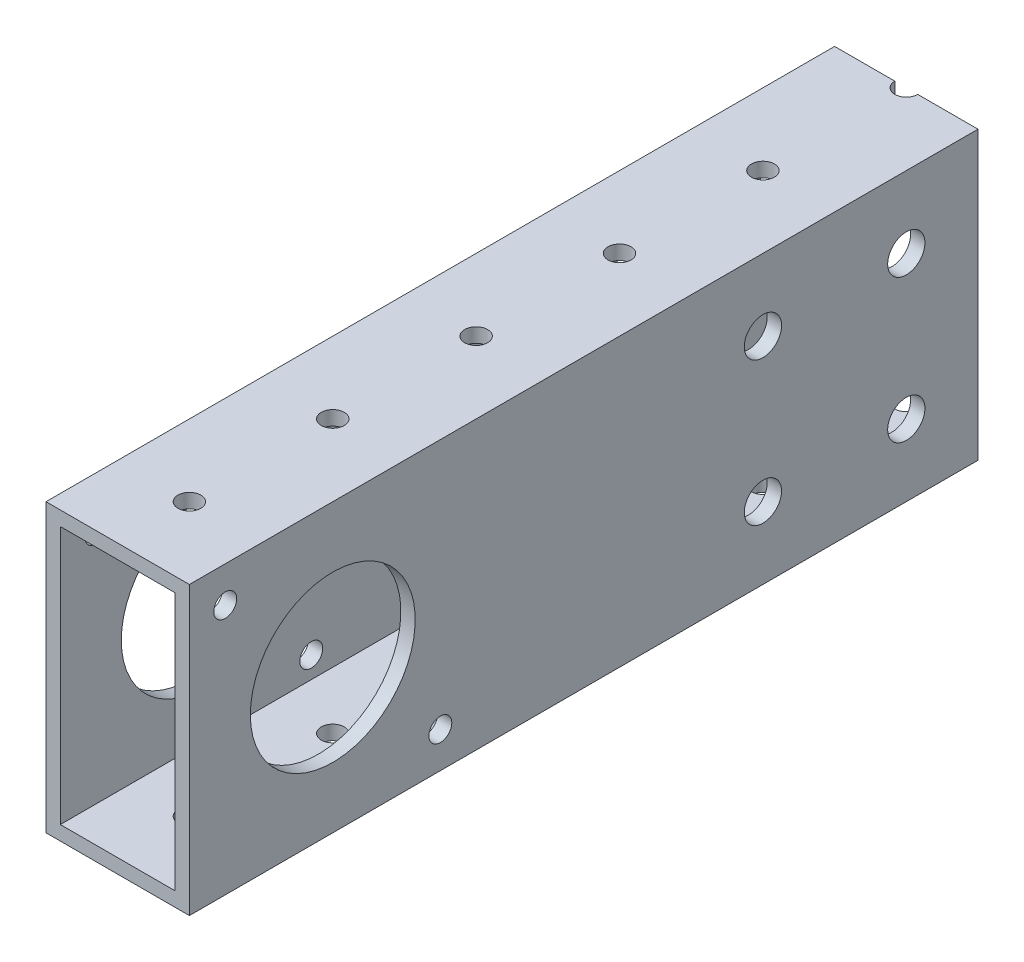
from build123d import *

# Parameters (mm, degrees)
SKETCH1_W           = 25.4
SKETCH1_H           = 50.8
SKETCH1_W_2         = 20.32
SKETCH1_H_2         = 45.72
BOSS_EXTRUDE1_DEPTH = 139.7
SKETCH2_R           = 2.032
CUT_EXTRUDE1_DEPTH  = 150.191219581
SKETCH3_R           = 2.032
SKETCH3_R_2         = 14.605
SKETCH3_R_3         = 3.302
CUT_EXTRUDE2_DEPTH  = 145.244271983


with BuildPart() as part:
    # Sketch1 → Boss-Extrude1 (new body)
    with BuildSketch(Plane.XY):
        Rectangle(SKETCH1_W, SKETCH1_H)
        Rectangle(SKETCH1_W_2, SKETCH1_H_2, mode=Mode.SUBTRACT)
    extrude(amount=BOSS_EXTRUDE1_DEPTH)

    # Sketch2 → Cut-Extrude1 (cut, through all)
    with BuildSketch(Plane(origin=(0, 25.4, 0), x_dir=(1, 0, 0), z_dir=(0, 1, 0))):
        Circle(SKETCH2_R)
        with Locations(Location((0, -25.4, 0), (0, 0, 270))):
            Circle(SKETCH2_R)
        with Locations(Location((0, -50.8, 0), (0, 0, 270))):
            Circle(SKETCH2_R)
        with Locations(Location((0, -76.2, 0), (0, 0, 270))):
            Circle(SKETCH2_R)
        with Locations(Location((0, -101.6, 0), (0, 0, 270))):
            Circle(SKETCH2_R)
        with Locations(Location((0, -127, 0), (0, 0, 270))):
            Circle(SKETCH2_R)
        with Locations((0, -152.4)):
            Circle(SKETCH2_R)
        with Locations((0, -177.8)):
            Circle(SKETCH2_R)
        with Locations((0, -203.2)):
            Circle(SKETCH2_R)
        with Locations((0, -228.6)):
            Circle(SKETCH2_R)
    extrude(amount=-CUT_EXTRUDE1_DEPTH, mode=Mode.SUBTRACT)

    # Sketch3 → Cut-Extrude2 (cut, through all)
    with BuildSketch(Plane.ZY.offset(12.7)):
        with Locations((133.35, 19.05)):
            Circle(SKETCH3_R)
        with Locations((95.25, -19.05)):
            Circle(SKETCH3_R)
        with Locations((114.3, 0)):
            Circle(SKETCH3_R_2)
        with Locations((12.7, 12.7)):
            Circle(SKETCH3_R_3)
        with Locations((38.1, 12.7)):
            Circle(SKETCH3_R_3)
        with Locations((38.1, -12.7)):
            Circle(SKETCH3_R_3)
        with Locations((12.7, -12.7)):
            Circle(SKETCH3_R_3)
    extrude(amount=-CUT_EXTRUDE2_DEPTH, mode=Mode.SUBTRACT)


solid = part.part
